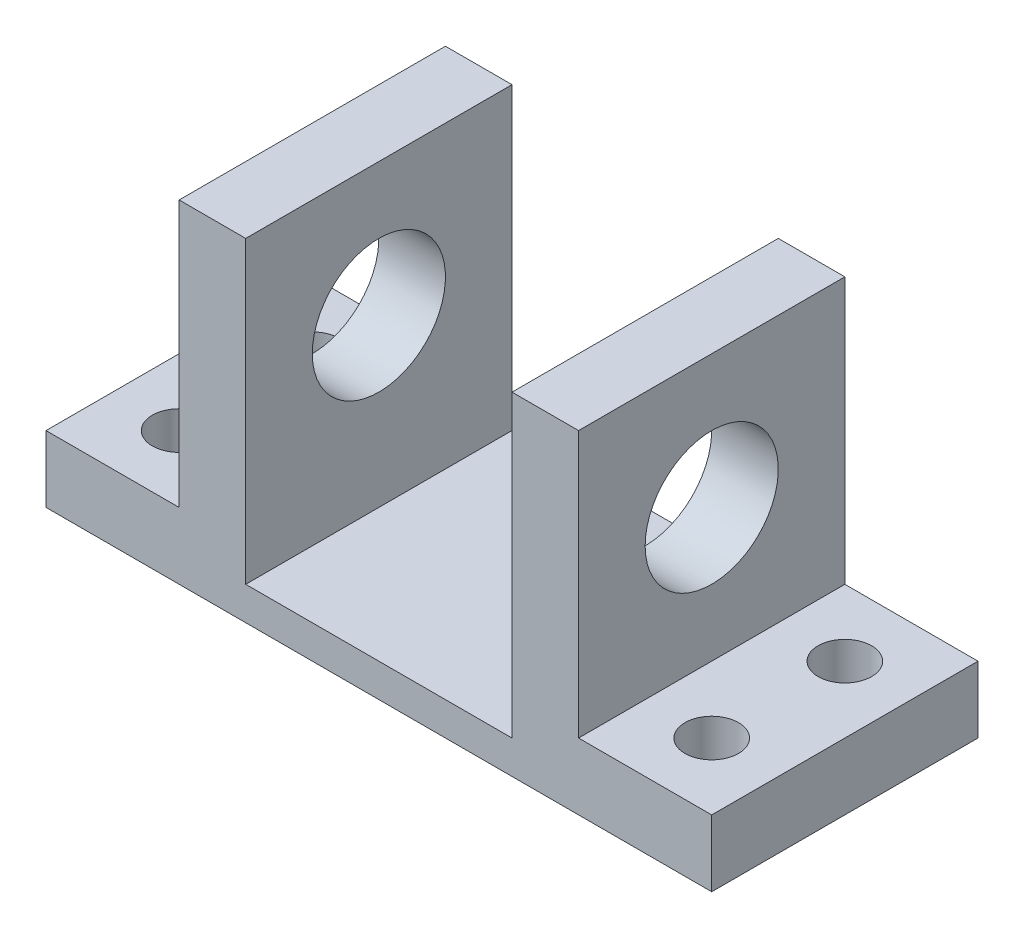
from build123d import *

# Parameters (mm, degrees)
SKETCH2_W                   = 6.35
SKETCH2_H                   = 25.4
BOSS_EXTRUDE1_DEPTH         = 31.75
BOSS_EXTRUDE1_2_DEPTH       = 31.75
SKETCH2_3_W                 = 25.4
SKETCH2_3_H                 = 25.4
BOSS_EXTRUDE2_DEPTH         = 3.175
SKETCH3_R                   = 6.35
CUT_EXTRUDE1_DEPTH          = 56.72102386
SKETCH4_W                   = 25.4
SKETCH4_H                   = 6.35
BOSS_EXTRUDE3_DEPTH         = 12.7
SKETCH9_W                   = 25.4
SKETCH9_H                   = 6.35
BOSS_EXTRUDE5_DEPTH         = 12.7
F_1_4_20_TAPPED_HOLE3_D     = 5.1054
F_1_4_20_TAPPED_HOLE3_DEPTH = 19.05
F_1_4_20_TAPPED_HOLE3_TIP   = 1.533816902


with BuildPart() as part:
    # Sketch2 → Boss-Extrude1 (new body)
    with BuildSketch(Plane(origin=(0, 0, 0), x_dir=(1, 0, 0), z_dir=(0, 1, 0))):
        with Locations((3.175, 12.7)):
            Rectangle(SKETCH2_W, SKETCH2_H)
    extrude(amount=BOSS_EXTRUDE1_DEPTH)



with BuildPart() as body_2:
    # Sketch2 → Boss-Extrude1 2 (new body)
    with BuildSketch(Plane(origin=(0, 0, 0), x_dir=(1, 0, 0), z_dir=(0, 1, 0))):
        with Locations((34.925, 12.7)):
            Rectangle(SKETCH2_W, SKETCH2_H)
    extrude(amount=BOSS_EXTRUDE1_2_DEPTH)


with BuildPart() as part_1:
    add(part.part)

    add(body_2.part)  # Boss-Extrude2 merges body 2
    # Sketch2<3> → Boss-Extrude2 (add)
    with BuildSketch(Plane(origin=(0, 0, 0), x_dir=(1, 0, 0), z_dir=(0, 1, 0))):
        with Locations((19.05, 12.7)):
            Rectangle(SKETCH2_3_W, SKETCH2_3_H)
    extrude(amount=BOSS_EXTRUDE2_DEPTH)

    # Sketch3 → Cut-Extrude1 (cut, through all)
    with BuildSketch(Plane.ZY):
        with Locations((-12.7, 19.05)):
            Circle(SKETCH3_R)
    extrude(amount=-CUT_EXTRUDE1_DEPTH, mode=Mode.SUBTRACT)

    # Sketch4 → Boss-Extrude3 (add)
    with BuildSketch(Plane.ZY):
        with Locations((-12.7, 3.175)):
            Rectangle(SKETCH4_W, SKETCH4_H)
    extrude(amount=BOSS_EXTRUDE3_DEPTH)

    # Sketch9 → Boss-Extrude5 (add)
    with BuildSketch(Plane(origin=(38.1, 0, 0), x_dir=(0, 0, -1), z_dir=(1, 0, 0))):
        with Locations((12.7, 3.175)):
            Rectangle(SKETCH9_W, SKETCH9_H)
    extrude(amount=BOSS_EXTRUDE5_DEPTH)

    # 1/4-20 Tapped Hole3
    with Locations(Plane(origin=(-6.35, 6.35, -19.05), x_dir=(0, 0, 1), z_dir=(0, 1, 0))):
        with Locations((0, 0), (12.7, 0), (12.7, 50.8), (0, 50.8)):
            Hole(F_1_4_20_TAPPED_HOLE3_D / 2, depth=F_1_4_20_TAPPED_HOLE3_DEPTH)
            with Locations((0, 0, -(F_1_4_20_TAPPED_HOLE3_DEPTH + F_1_4_20_TAPPED_HOLE3_TIP / 2))):  # 118° drill point
                Cone(0, F_1_4_20_TAPPED_HOLE3_D / 2, F_1_4_20_TAPPED_HOLE3_TIP, mode=Mode.SUBTRACT)


solid = part_1.part
